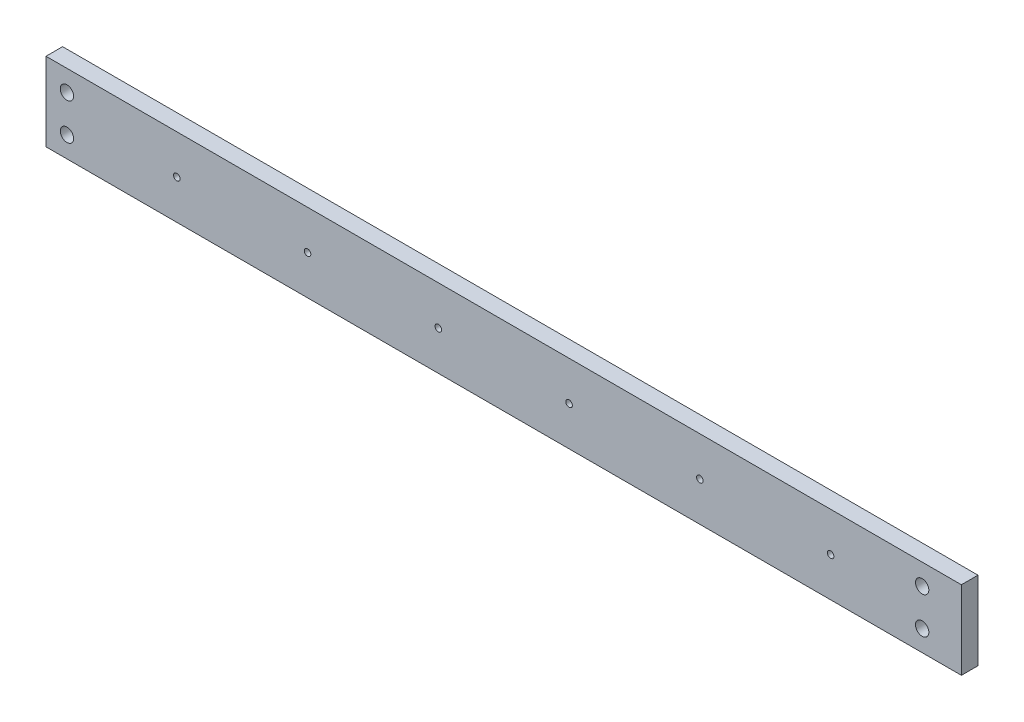
from build123d import *

# Parameters (mm, degrees)
SKETCH2_W                   = 350
SKETCH2_H                   = 30
BOSS_EXTRUDE1_DEPTH         = 6.35
TAP_DRILL_FOR_1_4_20_TAP2_D = 5.1054
TAP_DRILL_FOR_M3X0_5_TAP1_D = 2.5
LPATTERN1_COUNT             = 6
LPATTERN1_PITCH             = 50
TAP_DRILL_FOR_1_4_20_TAP1_D = 5.1054


with BuildPart() as part:
    # Sketch2 → Boss-Extrude1 (new body)
    with BuildSketch(Plane.XY):
        with Locations((175, 15)):
            Rectangle(SKETCH2_W, SKETCH2_H)
    extrude(amount=BOSS_EXTRUDE1_DEPTH)

    # Tap Drill for 1/4-20 Tap2 (through all)
    with Locations(Plane.XY.offset(6.35)):
        with Locations((8, 22), (8, 8)):
            Hole(TAP_DRILL_FOR_1_4_20_TAP2_D / 2)

    # Tap Drill for M3x0.5 Tap1 (through all)
    with Locations(Plane.XY.offset(6.35)):
        with Locations((50, 15)):
            tap_drill_for_m3x0_5_tap1 = Hole(TAP_DRILL_FOR_M3X0_5_TAP1_D / 2)

    # LPattern1: Tap Drill for M3x0.5 Tap1 ×6
    with Locations(*[(i * LPATTERN1_PITCH, 0, 0) for i in range(1, LPATTERN1_COUNT)]):
        add(tap_drill_for_m3x0_5_tap1, mode=Mode.SUBTRACT)

    # Tap Drill for 1/4-20 Tap1 (through all)
    with Locations(Plane(origin=(0, 0, 0), x_dir=(-1, 0, 0), z_dir=(0, 0, -1))):
        with Locations((-335, 22), (-335, 8)):
            Hole(TAP_DRILL_FOR_1_4_20_TAP1_D / 2)


solid = part.part
